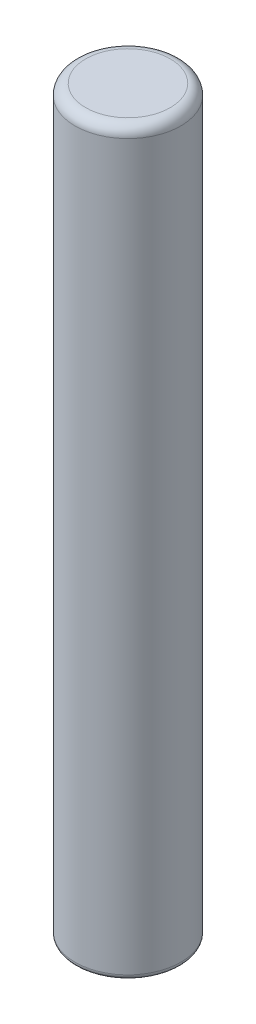
from build123d import *
from OCP.BRepFilletAPI import BRepFilletAPI_MakeFillet

# Parameters (mm, degrees)
EXTRUDE_1_DEPTH      = 7
EXTRUDE_1_DEPTH_BACK = 7
SKETCH_1_R           = 1
FILLET_1_R1          = 0.2
FILLET_1_R2          = 0.1


with BuildPart() as part:
    # 草图1 → 凸台-拉伸1 (new, two sides: drawn at the far end of the back side and taken through both)
    with BuildSketch(Plane(origin=(0, 0, 0), x_dir=(1, 0, 0), z_dir=(0, 1, 0)).offset(-EXTRUDE_1_DEPTH_BACK)):
        Circle(SKETCH_1_R)
    extrude(amount=EXTRUDE_1_DEPTH + EXTRUDE_1_DEPTH_BACK)

    # 圆角1: one fillet with a radius per group of edges: ONE call of the kernel's fillet builder (fillet() takes one radius for all edges)
    fillet_1_edges_1 = [part.edges().sort_by_distance(p)[0] for p in [
        (-1, 7, 0),
    ]]
    fillet_1_edges_2 = [part.edges().sort_by_distance(p)[0] for p in [
        (-1, -7, 0),
    ]]
    fillet_1 = BRepFilletAPI_MakeFillet(part.part.solid().wrapped)
    for e in fillet_1_edges_1:
        fillet_1.Add(FILLET_1_R1, e.wrapped)
    for e in fillet_1_edges_2:
        fillet_1.Add(FILLET_1_R2, e.wrapped)
    add(Compound.cast(fillet_1.Shape()), mode=Mode.REPLACE)


solid = part.part
